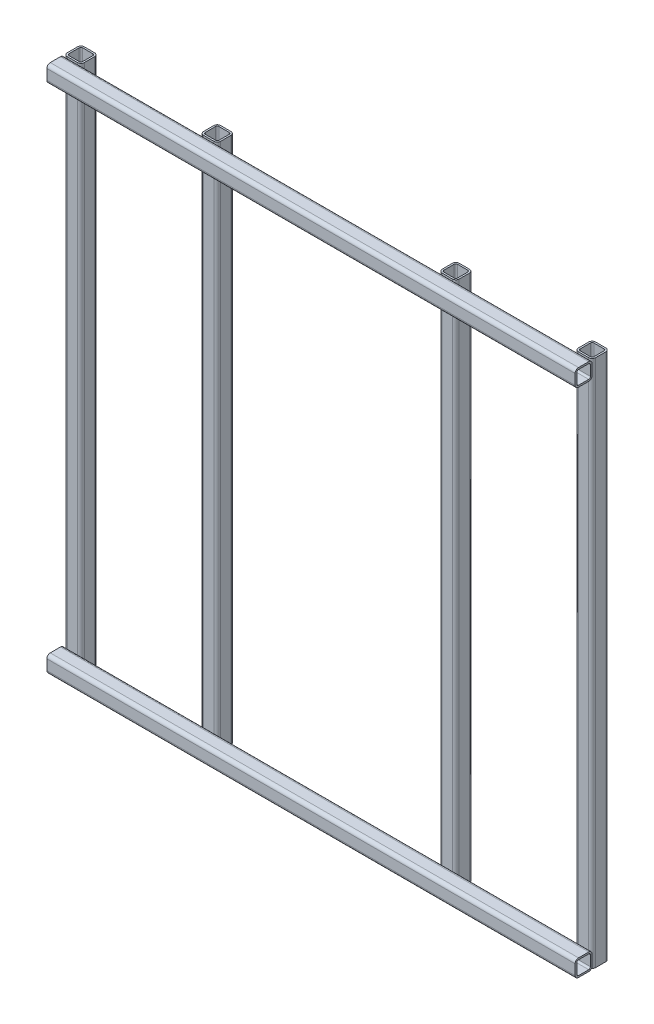
from build123d import *

# Parameters (mm, degrees)
SQUARE_TUBE_20_X_20_X_2_1_DEPTH   = 620
SQUARE_TUBE_20_X_20_X_2_1_2_DEPTH = 620
SQUARE_TUBE_20_X_20_X_2_1_3_DEPTH = 620
SQUARE_TUBE_20_X_20_X_2_1_4_DEPTH = 620
SQUARE_TUBE_20_X_20_X_2_1_5_DEPTH = 620
SQUARE_TUBE_20_X_20_X_2_1_6_DEPTH = 620


with BuildPart() as part:
    # Sketch12 → Square tube 20 X 20 X 2(1) (new body)
    with BuildSketch(Plane(origin=(600, 0, 0), x_dir=(1, 0, 0), z_dir=(0, -1, 0))):
        with BuildLine():
            Line((-6, -10), (6, -10))
            ThreePointArc((6, -10), (8.828427125, -8.828427125), (10, -6))
            Line((10, -6), (10, 6))
            ThreePointArc((10, 6), (8.828427125, 8.828427125), (6, 10))
            Line((6, 10), (-6, 10))
            ThreePointArc((-6, 10), (-8.828427125, 8.828427125), (-10, 6))
            Line((-10, 6), (-10, -6))
            ThreePointArc((-10, -6), (-8.828427125, -8.828427125), (-6, -10))
        make_face()
        with BuildLine():
            Line((-6, -8), (6, -8))
            ThreePointArc((6, -8), (7.414213562, -7.414213562), (8, -6))
            Line((8, -6), (8, 6))
            ThreePointArc((8, 6), (7.414213562, 7.414213562), (6, 8))
            Line((6, 8), (-6, 8))
            ThreePointArc((-6, 8), (-7.414213562, 7.414213562), (-8, 6))
            Line((-8, 6), (-8, -6))
            ThreePointArc((-8, -6), (-7.414213562, -7.414213562), (-6, -8))
        make_face(mode=Mode.SUBTRACT)
    extrude(amount=SQUARE_TUBE_20_X_20_X_2_1_DEPTH)


with BuildPart() as body_2:
    # Sketch12 on segment 2 (carried to segment 2) → Square tube 20 X 20 X 2_1 2 (new body)
    with BuildSketch(Plane.XZ):
        with BuildLine():
            Line((-6, -10), (6, -10))
            ThreePointArc((6, -10), (8.828427125, -8.828427125), (10, -6))
            Line((10, -6), (10, 6))
            ThreePointArc((10, 6), (8.828427125, 8.828427125), (6, 10))
            Line((6, 10), (-6, 10))
            ThreePointArc((-6, 10), (-8.828427125, 8.828427125), (-10, 6))
            Line((-10, 6), (-10, -6))
            ThreePointArc((-10, -6), (-8.828427125, -8.828427125), (-6, -10))
        make_face()
        with BuildLine():
            Line((-6, -8), (6, -8))
            ThreePointArc((6, -8), (7.414213562, -7.414213562), (8, -6))
            Line((8, -6), (8, 6))
            ThreePointArc((8, 6), (7.414213562, 7.414213562), (6, 8))
            Line((6, 8), (-6, 8))
            ThreePointArc((-6, 8), (-7.414213562, 7.414213562), (-8, 6))
            Line((-8, 6), (-8, -6))
            ThreePointArc((-8, -6), (-7.414213562, -7.414213562), (-6, -8))
        make_face(mode=Mode.SUBTRACT)
    extrude(amount=SQUARE_TUBE_20_X_20_X_2_1_2_DEPTH)


with BuildPart() as body_3:
    # Sketch12 on segment 3 (carried to segment 3) → Square tube 20 X 20 X 2_1 3 (new body)
    with BuildSketch(Plane(origin=(440, 0, 0), x_dir=(1, 0, 0), z_dir=(0, -1, 0))):
        with BuildLine():
            Line((-6, -10), (6, -10))
            ThreePointArc((6, -10), (8.828427125, -8.828427125), (10, -6))
            Line((10, -6), (10, 6))
            ThreePointArc((10, 6), (8.828427125, 8.828427125), (6, 10))
            Line((6, 10), (-6, 10))
            ThreePointArc((-6, 10), (-8.828427125, 8.828427125), (-10, 6))
            Line((-10, 6), (-10, -6))
            ThreePointArc((-10, -6), (-8.828427125, -8.828427125), (-6, -10))
        make_face()
        with BuildLine():
            Line((-6, -8), (6, -8))
            ThreePointArc((6, -8), (7.414213562, -7.414213562), (8, -6))
            Line((8, -6), (8, 6))
            ThreePointArc((8, 6), (7.414213562, 7.414213562), (6, 8))
            Line((6, 8), (-6, 8))
            ThreePointArc((-6, 8), (-7.414213562, 7.414213562), (-8, 6))
            Line((-8, 6), (-8, -6))
            ThreePointArc((-8, -6), (-7.414213562, -7.414213562), (-6, -8))
        make_face(mode=Mode.SUBTRACT)
    extrude(amount=SQUARE_TUBE_20_X_20_X_2_1_3_DEPTH)


with BuildPart() as body_4:
    # Sketch12 on segment 4 (carried to segment 4) → Square tube 20 X 20 X 2_1 4 (new body)
    with BuildSketch(Plane(origin=(160, 0, 0), x_dir=(1, 0, 0), z_dir=(0, -1, 0))):
        with BuildLine():
            Line((-6, -10), (6, -10))
            ThreePointArc((6, -10), (8.828427125, -8.828427125), (10, -6))
            Line((10, -6), (10, 6))
            ThreePointArc((10, 6), (8.828427125, 8.828427125), (6, 10))
            Line((6, 10), (-6, 10))
            ThreePointArc((-6, 10), (-8.828427125, 8.828427125), (-10, 6))
            Line((-10, 6), (-10, -6))
            ThreePointArc((-10, -6), (-8.828427125, -8.828427125), (-6, -10))
        make_face()
        with BuildLine():
            Line((-6, -8), (6, -8))
            ThreePointArc((6, -8), (7.414213562, -7.414213562), (8, -6))
            Line((8, -6), (8, 6))
            ThreePointArc((8, 6), (7.414213562, 7.414213562), (6, 8))
            Line((6, 8), (-6, 8))
            ThreePointArc((-6, 8), (-7.414213562, 7.414213562), (-8, 6))
            Line((-8, 6), (-8, -6))
            ThreePointArc((-8, -6), (-7.414213562, -7.414213562), (-6, -8))
        make_face(mode=Mode.SUBTRACT)
    extrude(amount=SQUARE_TUBE_20_X_20_X_2_1_4_DEPTH)


with BuildPart() as body_5:
    # Sketch12 on segment 5 (carried to segment 5) → Square tube 20 X 20 X 2_1 5 (new body)
    with BuildSketch(Plane(origin=(-10, -610, 20), x_dir=(0, 1, 0), z_dir=(1, 0, 0))):
        with BuildLine():
            Line((-6, -10), (6, -10))
            ThreePointArc((6, -10), (8.828427125, -8.828427125), (10, -6))
            Line((10, -6), (10, 6))
            ThreePointArc((10, 6), (8.828427125, 8.828427125), (6, 10))
            Line((6, 10), (-6, 10))
            ThreePointArc((-6, 10), (-8.828427125, 8.828427125), (-10, 6))
            Line((-10, 6), (-10, -6))
            ThreePointArc((-10, -6), (-8.828427125, -8.828427125), (-6, -10))
        make_face()
        with BuildLine():
            Line((-6, -8), (6, -8))
            ThreePointArc((6, -8), (7.414213562, -7.414213562), (8, -6))
            Line((8, -6), (8, 6))
            ThreePointArc((8, 6), (7.414213562, 7.414213562), (6, 8))
            Line((6, 8), (-6, 8))
            ThreePointArc((-6, 8), (-7.414213562, 7.414213562), (-8, 6))
            Line((-8, 6), (-8, -6))
            ThreePointArc((-8, -6), (-7.414213562, -7.414213562), (-6, -8))
        make_face(mode=Mode.SUBTRACT)
    extrude(amount=SQUARE_TUBE_20_X_20_X_2_1_5_DEPTH)


with BuildPart() as body_6:
    # Sketch12 on segment 6 (carried to segment 6) → Square tube 20 X 20 X 2_1 6 (new body)
    with BuildSketch(Plane(origin=(-10, -10, 20), x_dir=(0, 1, 0), z_dir=(1, 0, 0))):
        with BuildLine():
            Line((-6, -10), (6, -10))
            ThreePointArc((6, -10), (8.828427125, -8.828427125), (10, -6))
            Line((10, -6), (10, 6))
            ThreePointArc((10, 6), (8.828427125, 8.828427125), (6, 10))
            Line((6, 10), (-6, 10))
            ThreePointArc((-6, 10), (-8.828427125, 8.828427125), (-10, 6))
            Line((-10, 6), (-10, -6))
            ThreePointArc((-10, -6), (-8.828427125, -8.828427125), (-6, -10))
        make_face()
        with BuildLine():
            Line((-6, -8), (6, -8))
            ThreePointArc((6, -8), (7.414213562, -7.414213562), (8, -6))
            Line((8, -6), (8, 6))
            ThreePointArc((8, 6), (7.414213562, 7.414213562), (6, 8))
            Line((6, 8), (-6, 8))
            ThreePointArc((-6, 8), (-7.414213562, 7.414213562), (-8, 6))
            Line((-8, 6), (-8, -6))
            ThreePointArc((-8, -6), (-7.414213562, -7.414213562), (-6, -8))
        make_face(mode=Mode.SUBTRACT)
    extrude(amount=SQUARE_TUBE_20_X_20_X_2_1_6_DEPTH)


solid = Compound([part.part, body_2.part, body_3.part, body_4.part, body_5.part, body_6.part])
